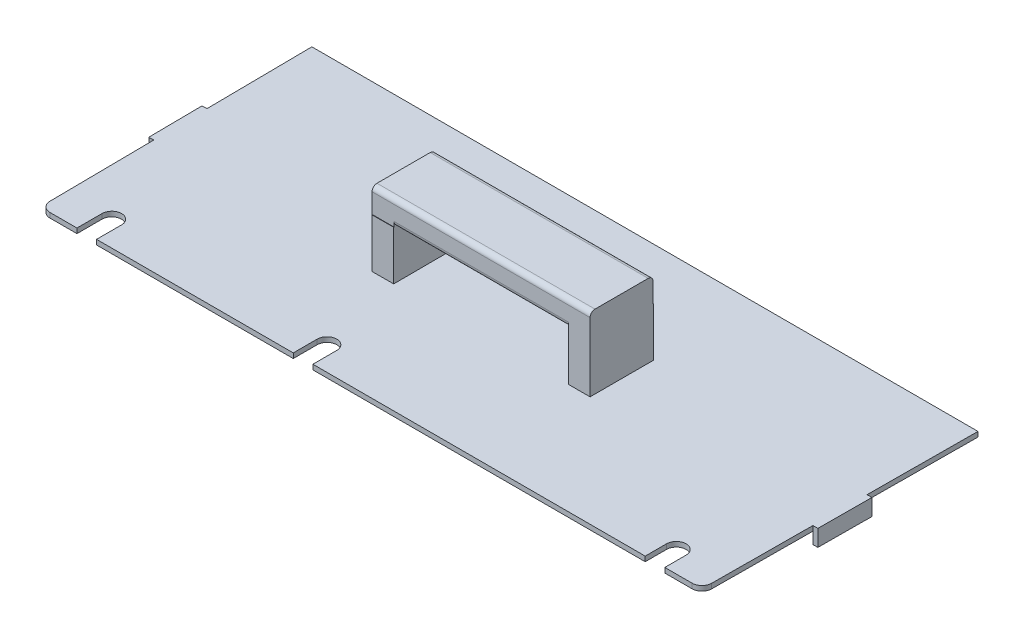
from build123d import *

# Parameters (mm, degrees)
BOSS_EXTRUDE1_DEPTH = 1
SKETCH3_W           = 4.432871168
SKETCH3_H           = 12.941954118
BOSS_EXTRUDE4_DEPTH = 10
SKETCH4_W           = 44.453613632
SKETCH4_H           = 12.853731213
BOSS_EXTRUDE6_DEPTH = 5
CUT_EXTRUDE1_DEPTH  = 5
FILLET3_R           = 1
FILLET4_R           = 1
SKETCH7_W           = 10.96861972
SKETCH7_H           = 3.370404632
BOSS_EXTRUDE7_DEPTH = 1
SKETCH9_W           = 10.967095029
SKETCH9_H           = 3.370404632
BOSS_EXTRUDE8_DEPTH = 1


with BuildPart() as part:
    # Sketch1 → Boss-Extrude1 (new body)
    with BuildSketch(Plane(origin=(0, 0, 0), x_dir=(1, 0, 0), z_dir=(0, 1, 0))):
        with BuildLine():
            Line((76.59869755, -62.780974611), (76.937608383, -8.810873689))
            Line((76.937608383, -8.810873689), (-58.911197585, -8.810873689))
            Line((-58.911197585, -8.810873689), (-58.350110804, -62.789203863))
            ThreePointArc((-58.350110804, -62.789203863), (-57.757063466, -64.189959956), (-56.350218844, -64.768415651))
            Line((-56.350218844, -64.768415651), (74.598736982, -64.768415651))
            ThreePointArc((74.598736982, -64.768415651), (76.008503289, -64.187062528), (76.59869755, -62.780974611))
        make_face()
    extrude(amount=BOSS_EXTRUDE1_DEPTH)

    # Sketch3 → Boss-Extrude4 (add)
    with BuildSketch(Plane(origin=(0, 1, 0), x_dir=(1, 0, 0), z_dir=(0, 1, 0))):
        Polygon((-13.121429489, -42.356471833), (-8.688593239, -42.338876898), (-8.739962395, -29.397024728), (-13.172798644, -29.414619663), align=None)
        with Locations((29.064379404, -35.797373817)):
            Rectangle(SKETCH3_W, SKETCH3_H)
    extrude(amount=BOSS_EXTRUDE4_DEPTH)

    # Sketch4 → Boss-Extrude6 (add)
    with BuildSketch(Plane(origin=(0, 11, 0), x_dir=(1, 0, 0), z_dir=(0, 1, 0))):
        with Locations((9.054008172, -35.841485269)):
            Rectangle(SKETCH4_W, SKETCH4_H)
    extrude(amount=BOSS_EXTRUDE6_DEPTH)

    # Sketch5 → Cut-Extrude1 (cut)
    with BuildSketch(Plane(origin=(0, 1, 0), x_dir=(1, 0, 0), z_dir=(0, 1, 0))):
        with BuildLine():
            Line((-50.865239297, -59.658136879), (-50.865239297, -64.768415651))
            Line((-50.865239297, -64.768415651), (-46.865239297, -64.768415651))
            Line((-46.865239297, -64.768415651), (-46.865239297, -59.658136879))
            ThreePointArc((-46.865239297, -59.658136879), (-48.865239297, -57.658136879), (-50.865239297, -59.658136879))
        make_face()
        with BuildLine():
            Line((-6.748499038, -59.890356529), (-6.748499038, -64.768415651))
            Line((-6.748499038, -64.768415651), (-2.748499038, -64.768415651))
            Line((-2.748499038, -64.768415651), (-2.748499038, -59.890356529))
            ThreePointArc((-2.748499038, -59.890356529), (-4.748499038, -57.890356529), (-6.748499038, -59.890356529))
        make_face()
        with BuildLine():
            Line((65.024259069, -60.427024757), (65.024259069, -64.768415651))
            Line((65.024259069, -64.768415651), (69.024259069, -64.768415651))
            Line((69.024259069, -64.768415651), (69.024259069, -60.427024757))
            ThreePointArc((69.024259069, -60.427024757), (67.024259069, -58.427024757), (65.024259069, -60.427024757))
        make_face()
    extrude(amount=-CUT_EXTRUDE1_DEPTH, mode=Mode.SUBTRACT)

    # Fillet3
    fillet3_edges = [part.edges().sort_by_distance(p)[0] for p in [
        (9.054008172, 16, 29.414619663),
        (9.054008172, 16, 42.268350876),
    ]]
    fillet(fillet3_edges, radius=FILLET3_R)

    # Fillet4
    fillet4_edges = [part.edges().sort_by_distance(p)[0] for p in [
        (9.079535323, 11, 42.268350876),
        (9.054025631, 11, 29.414619663),
    ]]
    fillet(fillet4_edges, radius=FILLET4_R)

    # Sketch7 → Boss-Extrude7 (add)
    with BuildSketch(Plane(origin=(-58.996409176, 0, 0.613248042), x_dir=(0.010394105727731903, 0, 0.9999459798239707), z_dir=(-0.9999459798239707, 0, 0.010394105727731903))):
        with Locations((35.300658133, -0.685202316)):
            Rectangle(SKETCH7_W, SKETCH7_H)
    extrude(amount=BOSS_EXTRUDE7_DEPTH)

    # Sketch9 → Boss-Extrude8 (add)
    with BuildSketch(Plane(origin=(76.989901201, 0, 0.483466051), x_dir=(0.0062794796676542385, 0, -0.9999802838731889), z_dir=(0.9999802838731889, 0, 0.0062794796676542385))):
        with Locations((-36.296126915, -0.685202316)):
            Rectangle(SKETCH9_W, SKETCH9_H)
    extrude(amount=BOSS_EXTRUDE8_DEPTH)


solid = part.part
